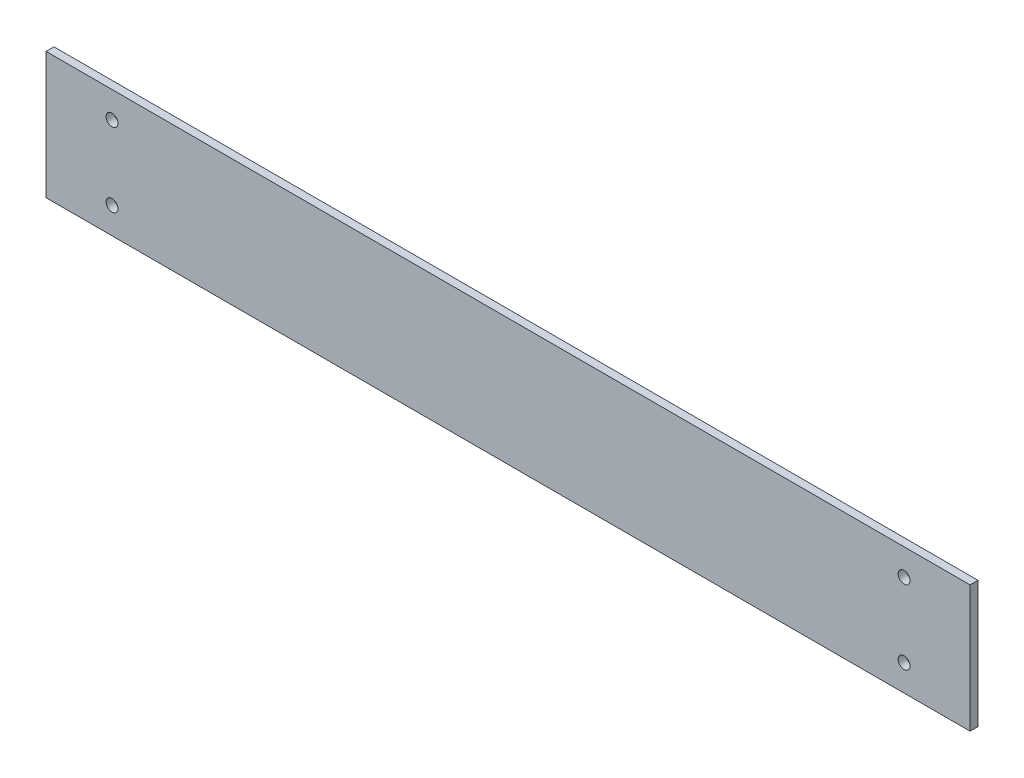
from build123d import *

# Parameters (mm, degrees)
ESQUISSE1_W             = 350
ESQUISSE1_H             = 48
BOSS_EXTRU_1_DEPTH      = 3
ENL_V_MAT_EXTRU_1_REACH = 178.664
ESQUISSE2_R             = 2.25


with BuildPart() as part:
    # Esquisse1 → Boss.-Extru.1 (new body)
    with BuildSketch(Plane.XY):
        Rectangle(ESQUISSE1_W, ESQUISSE1_H)
    extrude(amount=BOSS_EXTRU_1_DEPTH)

    # Esquisse2 → Enlèv. mat.-Extru.1 (cut, up to next)
    with BuildSketch(Plane.XY.offset(3), mode=Mode.PRIVATE) as enl_v_mat_extru_1_sk1:
        with Locations((-150, 14)):
            Circle(ESQUISSE2_R)
    enl_v_mat_extru_1_tool1 = extrude(enl_v_mat_extru_1_sk1.sketch, amount=-ENL_V_MAT_EXTRU_1_REACH, mode=Mode.PRIVATE) & part.part
    # Esquisse2 → Enlèv. mat.-Extru.1 (cut, up to next)
    with BuildSketch(Plane.XY.offset(3), mode=Mode.PRIVATE) as enl_v_mat_extru_1_sk2:
        with Locations((-150, -14)):
            Circle(ESQUISSE2_R)
    enl_v_mat_extru_1_tool2 = extrude(enl_v_mat_extru_1_sk2.sketch, amount=-ENL_V_MAT_EXTRU_1_REACH, mode=Mode.PRIVATE) & part.part
    # Esquisse2 → Enlèv. mat.-Extru.1 (cut, up to next)
    with BuildSketch(Plane.XY.offset(3), mode=Mode.PRIVATE) as enl_v_mat_extru_1_sk3:
        with Locations((150, 14)):
            Circle(ESQUISSE2_R)
    enl_v_mat_extru_1_tool3 = extrude(enl_v_mat_extru_1_sk3.sketch, amount=-ENL_V_MAT_EXTRU_1_REACH, mode=Mode.PRIVATE) & part.part
    # Esquisse2 → Enlèv. mat.-Extru.1 (cut, up to next)
    with BuildSketch(Plane.XY.offset(3), mode=Mode.PRIVATE) as enl_v_mat_extru_1_sk4:
        with Locations((150, -14)):
            Circle(ESQUISSE2_R)
    enl_v_mat_extru_1_tool4 = extrude(enl_v_mat_extru_1_sk4.sketch, amount=-ENL_V_MAT_EXTRU_1_REACH, mode=Mode.PRIVATE) & part.part
    add(enl_v_mat_extru_1_tool1.solids().sort_by_distance((-150, 14, 3))[0], mode=Mode.SUBTRACT)
    add(enl_v_mat_extru_1_tool2.solids().sort_by_distance((-150, -14, 3))[0], mode=Mode.SUBTRACT)
    add(enl_v_mat_extru_1_tool3.solids().sort_by_distance((150, 14, 3))[0], mode=Mode.SUBTRACT)
    add(enl_v_mat_extru_1_tool4.solids().sort_by_distance((150, -14, 3))[0], mode=Mode.SUBTRACT)


solid = part.part
